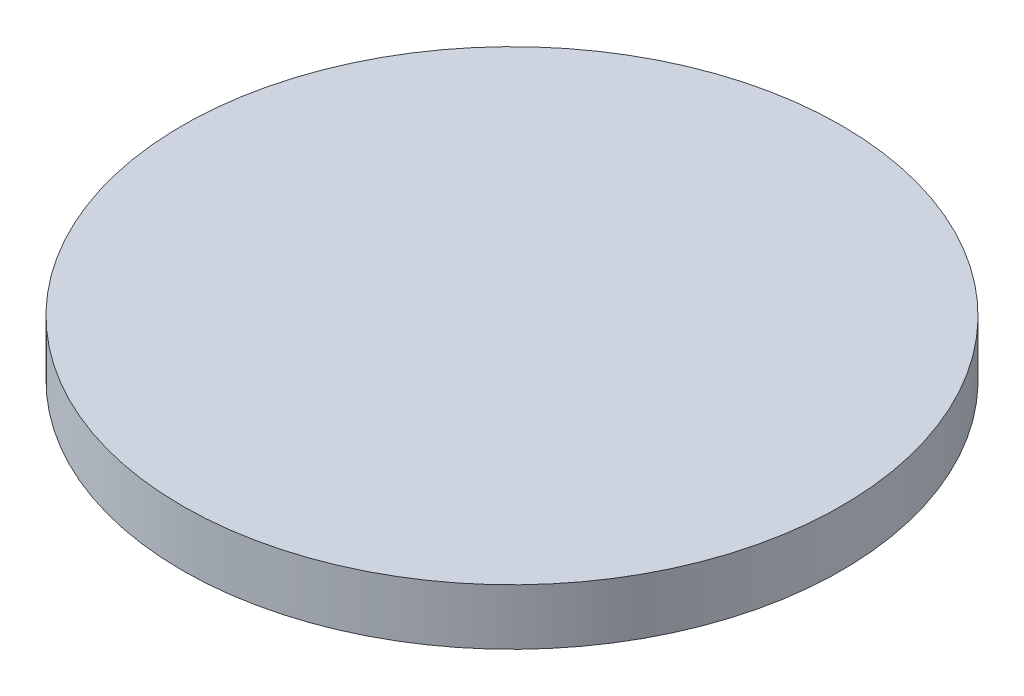
from build123d import *

# Parameters (mm, degrees)
SKETCH1_R           = 16.75
BOSS_EXTRUDE1_DEPTH = 2.84


with BuildPart() as part:
    # Sketch1 → Boss-Extrude1 (new body)
    with BuildSketch(Plane(origin=(0, 0, 0), x_dir=(1, 0, 0), z_dir=(0, 1, 0))):
        with Locations(Location((0, 0, 0), (0, 0, 90))):
            Circle(SKETCH1_R)
    extrude(amount=BOSS_EXTRUDE1_DEPTH)


solid = part.part
